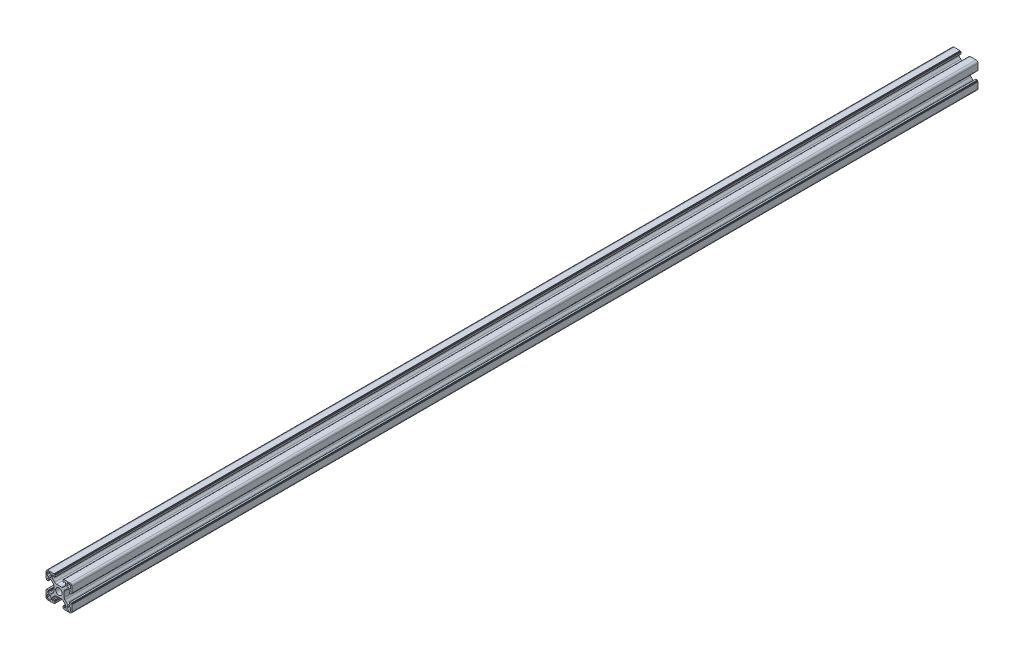
from build123d import *

# Parameters (mm, degrees)
EXTRUDE_1_DEPTH = 701


with BuildPart() as part:
    # Эскиз1 → Бобышка-Вытянуть1 (new body)
    with BuildSketch(Plane.XY):
        with BuildLine():
            Line((0.518669919, 3.776487723), (2.417450588, 3.776487723))
            ThreePointArc((2.417450588, 3.776487723), (3.182817452, 3.928728658), (3.83166415, 4.362274161))
            Line((3.83166415, 4.362274161), (5.132883481, 5.663493491))
            ThreePointArc((5.132883481, 5.663493491), (5.566428984, 6.312340189), (5.718669919, 7.077707054))
            Line((5.718669919, 7.077707054), (5.718669919, 7.976487723))
            ThreePointArc((5.718669919, 7.976487723), (5.572223309, 8.330041114), (5.218669919, 8.476487723))
            Line((5.218669919, 8.476487723), (5.1157767, 8.476487723))
            ThreePointArc((5.1157767, 8.476487723), (4.924434984, 8.438427489), (4.762223309, 8.330041114))
            Line((4.762223309, 8.330041114), (4.281893223, 7.849711028))
            ThreePointArc((4.281893223, 7.849711028), (4.200787386, 7.79551784), (4.105116528, 7.776487723))
            Line((4.105116528, 7.776487723), (3.818669919, 7.776487723))
            ThreePointArc((3.818669919, 7.776487723), (3.641893223, 7.849711028), (3.568669919, 8.026487723))
            Line((3.568669919, 8.026487723), (3.568669919, 9.175558543))
            ThreePointArc((3.568669919, 9.175558543), (3.612603901, 9.281624561), (3.718669919, 9.325558543))
            Line((3.718669919, 9.325558543), (4.218669919, 9.325558543))
            Line((4.218669919, 9.325558543), (4.218669919, 9.626487723))
            ThreePointArc((4.218669919, 9.626487723), (4.262603901, 9.73255374), (4.368669919, 9.776487723))
            Line((4.368669919, 9.776487723), (9.018669919, 9.776487723))
            ThreePointArc((9.018669919, 9.776487723), (10.07933009, 9.337147895), (10.518669919, 8.276487723))
            Line((10.518669919, 8.276487723), (10.518669919, 3.626487723))
            ThreePointArc((10.518669919, 3.626487723), (10.474735936, 3.520421706), (10.368669919, 3.476487723))
            Line((10.368669919, 3.476487723), (10.067740739, 3.476487723))
            Line((10.067740739, 3.476487723), (10.067740739, 2.976487723))
            ThreePointArc((10.067740739, 2.976487723), (10.023806756, 2.870421706), (9.917740739, 2.826487723))
            Line((9.917740739, 2.826487723), (8.768669919, 2.826487723))
            ThreePointArc((8.768669919, 2.826487723), (8.591893223, 2.899711028), (8.518669919, 3.076487723))
            Line((8.518669919, 3.076487723), (8.518669919, 3.362934332))
            ThreePointArc((8.518669919, 3.362934332), (8.537700036, 3.45860519), (8.591893223, 3.539711028))
            Line((8.591893223, 3.539711028), (9.072223309, 4.020041114))
            ThreePointArc((9.072223309, 4.020041114), (9.180609685, 4.182252788), (9.218669919, 4.373594504))
            Line((9.218669919, 4.373594504), (9.218669919, 4.476487723))
            ThreePointArc((9.218669919, 4.476487723), (9.072223309, 4.830041114), (8.718669919, 4.976487723))
            Line((8.718669919, 4.976487723), (7.81988925, 4.976487723))
            ThreePointArc((7.81988925, 4.976487723), (7.054522385, 4.824246788), (6.405675687, 4.390701285))
            Line((6.405675687, 4.390701285), (5.104456356, 3.089481954))
            ThreePointArc((5.104456356, 3.089481954), (4.670910854, 2.440635257), (4.518669919, 1.675268392))
            Line((4.518669919, 1.675268392), (4.518669919, -0.223512277))
            Line((4.518669919, -0.223512277), (4.518669919, -2.122292946))
            ThreePointArc((4.518669919, -2.122292946), (4.670910854, -2.887659811), (5.104456356, -3.536506509))
            Line((5.104456356, -3.536506509), (6.405675687, -4.837725839))
            ThreePointArc((6.405675687, -4.837725839), (7.054522385, -5.271271342), (7.81988925, -5.423512277))
            Line((7.81988925, -5.423512277), (8.718669919, -5.423512277))
            ThreePointArc((8.718669919, -5.423512277), (9.072223309, -5.277065668), (9.218669919, -4.923512277))
            Line((9.218669919, -4.923512277), (9.218669919, -4.820619058))
            ThreePointArc((9.218669919, -4.820619058), (9.180609685, -4.629277342), (9.072223309, -4.467065668))
            Line((9.072223309, -4.467065668), (8.591893223, -3.986735582))
            ThreePointArc((8.591893223, -3.986735582), (8.537700036, -3.905629745), (8.518669919, -3.809958886))
            Line((8.518669919, -3.809958886), (8.518669919, -3.523512277))
            ThreePointArc((8.518669919, -3.523512277), (8.591893223, -3.346735582), (8.768669919, -3.273512277))
            Line((8.768669919, -3.273512277), (9.917740739, -3.273512277))
            ThreePointArc((9.917740739, -3.273512277), (10.023806756, -3.31744626), (10.067740739, -3.423512277))
            Line((10.067740739, -3.423512277), (10.067740739, -3.923512277))
            Line((10.067740739, -3.923512277), (10.368669919, -3.923512277))
            ThreePointArc((10.368669919, -3.923512277), (10.474735936, -3.96744626), (10.518669919, -4.073512277))
            Line((10.518669919, -4.073512277), (10.518669919, -8.723512277))
            ThreePointArc((10.518669919, -8.723512277), (10.07933009, -9.784172449), (9.018669919, -10.223512277))
            Line((9.018669919, -10.223512277), (4.368669919, -10.223512277))
            ThreePointArc((4.368669919, -10.223512277), (4.262603901, -10.179578294), (4.218669919, -10.073512277))
            Line((4.218669919, -10.073512277), (4.218669919, -9.772583098))
            Line((4.218669919, -9.772583098), (3.718669919, -9.772583098))
            ThreePointArc((3.718669919, -9.772583098), (3.612603901, -9.728649115), (3.568669919, -9.622583098))
            Line((3.568669919, -9.622583098), (3.568669919, -8.473512277))
            ThreePointArc((3.568669919, -8.473512277), (3.641893223, -8.296735582), (3.818669919, -8.223512277))
            Line((3.818669919, -8.223512277), (4.105116528, -8.223512277))
            ThreePointArc((4.105116528, -8.223512277), (4.200787386, -8.242542394), (4.281893223, -8.296735582))
            Line((4.281893223, -8.296735582), (4.762223309, -8.777065668))
            ThreePointArc((4.762223309, -8.777065668), (4.924434984, -8.885452043), (5.1157767, -8.923512277))
            Line((5.1157767, -8.923512277), (5.218669919, -8.923512277))
            ThreePointArc((5.218669919, -8.923512277), (5.572223309, -8.777065668), (5.718669919, -8.423512277))
            Line((5.718669919, -8.423512277), (5.718669919, -7.524731608))
            ThreePointArc((5.718669919, -7.524731608), (5.566428984, -6.759364743), (5.132883481, -6.110518046))
            Line((5.132883481, -6.110518046), (3.83166415, -4.809298715))
            ThreePointArc((3.83166415, -4.809298715), (3.182817452, -4.375753212), (2.417450588, -4.223512277))
            Line((2.417450588, -4.223512277), (0.518669919, -4.223512277))
            Line((0.518669919, -4.223512277), (-1.38011075, -4.223512277))
            ThreePointArc((-1.38011075, -4.223512277), (-2.145477615, -4.375753212), (-2.794324313, -4.809298715))
            Line((-2.794324313, -4.809298715), (-4.095543644, -6.110518046))
            ThreePointArc((-4.095543644, -6.110518046), (-4.529089146, -6.759364743), (-4.681330081, -7.524731608))
            Line((-4.681330081, -7.524731608), (-4.681330081, -8.423512277))
            ThreePointArc((-4.681330081, -8.423512277), (-4.534883472, -8.777065668), (-4.181330081, -8.923512277))
            Line((-4.181330081, -8.923512277), (-4.078436863, -8.923512277))
            ThreePointArc((-4.078436863, -8.923512277), (-3.887095146, -8.885452043), (-3.724883472, -8.777065668))
            Line((-3.724883472, -8.777065668), (-3.244553386, -8.296735582))
            ThreePointArc((-3.244553386, -8.296735582), (-3.163447549, -8.242542394), (-3.067776691, -8.223512277))
            Line((-3.067776691, -8.223512277), (-2.781330081, -8.223512277))
            ThreePointArc((-2.781330081, -8.223512277), (-2.604553386, -8.296735582), (-2.531330081, -8.473512277))
            Line((-2.531330081, -8.473512277), (-2.531330081, -9.622583098))
            ThreePointArc((-2.531330081, -9.622583098), (-2.575264064, -9.728649115), (-2.681330081, -9.772583098))
            Line((-2.681330081, -9.772583098), (-3.181330081, -9.772583098))
            Line((-3.181330081, -9.772583098), (-3.181330081, -10.073512277))
            ThreePointArc((-3.181330081, -10.073512277), (-3.225264064, -10.179578294), (-3.331330081, -10.223512277))
            Line((-3.331330081, -10.223512277), (-7.981330081, -10.223512277))
            ThreePointArc((-7.981330081, -10.223512277), (-9.041990253, -9.784172449), (-9.481330081, -8.723512277))
            Line((-9.481330081, -8.723512277), (-9.481330081, -4.073512277))
            ThreePointArc((-9.481330081, -4.073512277), (-9.437396099, -3.96744626), (-9.331330081, -3.923512277))
            Line((-9.331330081, -3.923512277), (-9.030400902, -3.923512277))
            Line((-9.030400902, -3.923512277), (-9.030400902, -3.423512277))
            ThreePointArc((-9.030400902, -3.423512277), (-8.986466919, -3.31744626), (-8.880400902, -3.273512277))
            Line((-8.880400902, -3.273512277), (-7.731330081, -3.273512277))
            ThreePointArc((-7.731330081, -3.273512277), (-7.554553386, -3.346735582), (-7.481330081, -3.523512277))
            Line((-7.481330081, -3.523512277), (-7.481330081, -3.809958886))
            ThreePointArc((-7.481330081, -3.809958886), (-7.500360198, -3.905629745), (-7.554553386, -3.986735582))
            Line((-7.554553386, -3.986735582), (-8.034883472, -4.467065668))
            ThreePointArc((-8.034883472, -4.467065668), (-8.143269848, -4.629277342), (-8.181330081, -4.820619058))
            Line((-8.181330081, -4.820619058), (-8.181330081, -4.923512277))
            ThreePointArc((-8.181330081, -4.923512277), (-8.034883472, -5.277065668), (-7.681330081, -5.423512277))
            Line((-7.681330081, -5.423512277), (-6.782549412, -5.423512277))
            ThreePointArc((-6.782549412, -5.423512277), (-6.017182548, -5.271271342), (-5.36833585, -4.837725839))
            Line((-5.36833585, -4.837725839), (-4.067116519, -3.536506509))
            ThreePointArc((-4.067116519, -3.536506509), (-3.633571016, -2.887659811), (-3.481330081, -2.122292946))
            Line((-3.481330081, -2.122292946), (-3.481330081, -0.223512277))
            Line((-3.481330081, -0.223512277), (-3.481330081, 1.675268392))
            ThreePointArc((-3.481330081, 1.675268392), (-3.633571016, 2.440635257), (-4.067116519, 3.089481954))
            Line((-4.067116519, 3.089481954), (-5.36833585, 4.390701285))
            ThreePointArc((-5.36833585, 4.390701285), (-6.017182548, 4.824246788), (-6.782549412, 4.976487723))
            Line((-6.782549412, 4.976487723), (-7.681330081, 4.976487723))
            ThreePointArc((-7.681330081, 4.976487723), (-8.034883472, 4.830041114), (-8.181330081, 4.476487723))
            Line((-8.181330081, 4.476487723), (-8.181330081, 4.373594504))
            ThreePointArc((-8.181330081, 4.373594504), (-8.143269848, 4.182252788), (-8.034883472, 4.020041114))
            Line((-8.034883472, 4.020041114), (-7.554553386, 3.539711028))
            ThreePointArc((-7.554553386, 3.539711028), (-7.500360198, 3.45860519), (-7.481330081, 3.362934332))
            Line((-7.481330081, 3.362934332), (-7.481330081, 3.076487723))
            ThreePointArc((-7.481330081, 3.076487723), (-7.554553386, 2.899711028), (-7.731330081, 2.826487723))
            Line((-7.731330081, 2.826487723), (-8.880400902, 2.826487723))
            ThreePointArc((-8.880400902, 2.826487723), (-8.986466919, 2.870421706), (-9.030400902, 2.976487723))
            Line((-9.030400902, 2.976487723), (-9.030400902, 3.476487723))
            Line((-9.030400902, 3.476487723), (-9.331330081, 3.476487723))
            ThreePointArc((-9.331330081, 3.476487723), (-9.437396099, 3.520421706), (-9.481330081, 3.626487723))
            Line((-9.481330081, 3.626487723), (-9.481330081, 8.276487723))
            ThreePointArc((-9.481330081, 8.276487723), (-9.041990253, 9.337147895), (-7.981330081, 9.776487723))
            Line((-7.981330081, 9.776487723), (-3.331330081, 9.776487723))
            ThreePointArc((-3.331330081, 9.776487723), (-3.225264064, 9.73255374), (-3.181330081, 9.626487723))
            Line((-3.181330081, 9.626487723), (-3.181330081, 9.325558543))
            Line((-3.181330081, 9.325558543), (-2.681330081, 9.325558543))
            ThreePointArc((-2.681330081, 9.325558543), (-2.575264064, 9.281624561), (-2.531330081, 9.175558543))
            Line((-2.531330081, 9.175558543), (-2.531330081, 8.026487723))
            ThreePointArc((-2.531330081, 8.026487723), (-2.604553386, 7.849711028), (-2.781330081, 7.776487723))
            Line((-2.781330081, 7.776487723), (-3.067776691, 7.776487723))
            ThreePointArc((-3.067776691, 7.776487723), (-3.163447549, 7.79551784), (-3.244553386, 7.849711028))
            Line((-3.244553386, 7.849711028), (-3.724883472, 8.330041114))
            ThreePointArc((-3.724883472, 8.330041114), (-3.887095146, 8.438427489), (-4.078436863, 8.476487723))
            Line((-4.078436863, 8.476487723), (-4.181330081, 8.476487723))
            ThreePointArc((-4.181330081, 8.476487723), (-4.534883472, 8.330041114), (-4.681330081, 7.976487723))
            Line((-4.681330081, 7.976487723), (-4.681330081, 7.077707054))
            ThreePointArc((-4.681330081, 7.077707054), (-4.529089146, 6.312340189), (-4.095543644, 5.663493491))
            Line((-4.095543644, 5.663493491), (-2.794324313, 4.362274161))
            ThreePointArc((-2.794324313, 4.362274161), (-2.145477615, 3.928728658), (-1.38011075, 3.776487723))
            Line((-1.38011075, 3.776487723), (0.518669919, 3.776487723))
        make_face()
        with BuildLine():
            Line((7.418669919, 5.876487723), (8.818669919, 5.876487723))
            ThreePointArc((8.818669919, 5.876487723), (9.384355344, 6.110802298), (9.618669919, 6.676487723))
            Line((9.618669919, 6.676487723), (9.618669919, 8.076487723))
            ThreePointArc((9.618669919, 8.076487723), (9.384355344, 8.642173148), (8.818669919, 8.876487723))
            Line((8.818669919, 8.876487723), (7.418669919, 8.876487723))
            ThreePointArc((7.418669919, 8.876487723), (6.852984494, 8.642173148), (6.618669919, 8.076487723))
            Line((6.618669919, 8.076487723), (6.618669919, 6.676487723))
            ThreePointArc((6.618669919, 6.676487723), (6.852984494, 6.110802298), (7.418669919, 5.876487723))
        make_face(mode=Mode.SUBTRACT)
        with BuildLine():
            Line((6.618669919, -7.123512277), (6.618669919, -8.523512277))
            ThreePointArc((6.618669919, -8.523512277), (6.852984494, -9.089197702), (7.418669919, -9.323512277))
            Line((7.418669919, -9.323512277), (8.818669919, -9.323512277))
            ThreePointArc((8.818669919, -9.323512277), (9.384355344, -9.089197702), (9.618669919, -8.523512277))
            Line((9.618669919, -8.523512277), (9.618669919, -7.123512277))
            ThreePointArc((9.618669919, -7.123512277), (9.384355344, -6.557826852), (8.818669919, -6.323512277))
            Line((8.818669919, -6.323512277), (7.418669919, -6.323512277))
            ThreePointArc((7.418669919, -6.323512277), (6.852984494, -6.557826852), (6.618669919, -7.123512277))
        make_face(mode=Mode.SUBTRACT)
        with BuildLine():
            Line((-6.381330081, -6.323512277), (-7.781330081, -6.323512277))
            ThreePointArc((-7.781330081, -6.323512277), (-8.347015506, -6.557826852), (-8.581330081, -7.123512277))
            Line((-8.581330081, -7.123512277), (-8.581330081, -8.523512277))
            ThreePointArc((-8.581330081, -8.523512277), (-8.347015506, -9.089197702), (-7.781330081, -9.323512277))
            Line((-7.781330081, -9.323512277), (-6.381330081, -9.323512277))
            ThreePointArc((-6.381330081, -9.323512277), (-5.815644656, -9.089197702), (-5.581330081, -8.523512277))
            Line((-5.581330081, -8.523512277), (-5.581330081, -7.123512277))
            ThreePointArc((-5.581330081, -7.123512277), (-5.815644656, -6.557826852), (-6.381330081, -6.323512277))
        make_face(mode=Mode.SUBTRACT)
        with BuildLine():
            Line((-5.581330081, 6.676487723), (-5.581330081, 8.076487723))
            ThreePointArc((-5.581330081, 8.076487723), (-5.815644656, 8.642173148), (-6.381330081, 8.876487723))
            Line((-6.381330081, 8.876487723), (-7.781330081, 8.876487723))
            ThreePointArc((-7.781330081, 8.876487723), (-8.347015506, 8.642173148), (-8.581330081, 8.076487723))
            Line((-8.581330081, 8.076487723), (-8.581330081, 6.676487723))
            ThreePointArc((-8.581330081, 6.676487723), (-8.347015506, 6.110802298), (-7.781330081, 5.876487723))
            Line((-7.781330081, 5.876487723), (-6.381330081, 5.876487723))
            ThreePointArc((-6.381330081, 5.876487723), (-5.815644656, 6.110802298), (-5.581330081, 6.676487723))
        make_face(mode=Mode.SUBTRACT)
        with BuildLine():
            ThreePointArc((3.018669919, -0.223512277), (2.286436872, 1.544254676), (0.518669919, 2.276487723))
            ThreePointArc((0.518669919, 2.276487723), (-1.249097034, 1.544254676), (-1.981330081, -0.223512277))
            ThreePointArc((-1.981330081, -0.223512277), (-1.249097034, -1.99127923), (0.518669919, -2.723512277))
            ThreePointArc((0.518669919, -2.723512277), (2.286436872, -1.99127923), (3.018669919, -0.223512277))
        make_face(mode=Mode.SUBTRACT)
    extrude(amount=EXTRUDE_1_DEPTH)


solid = part.part
